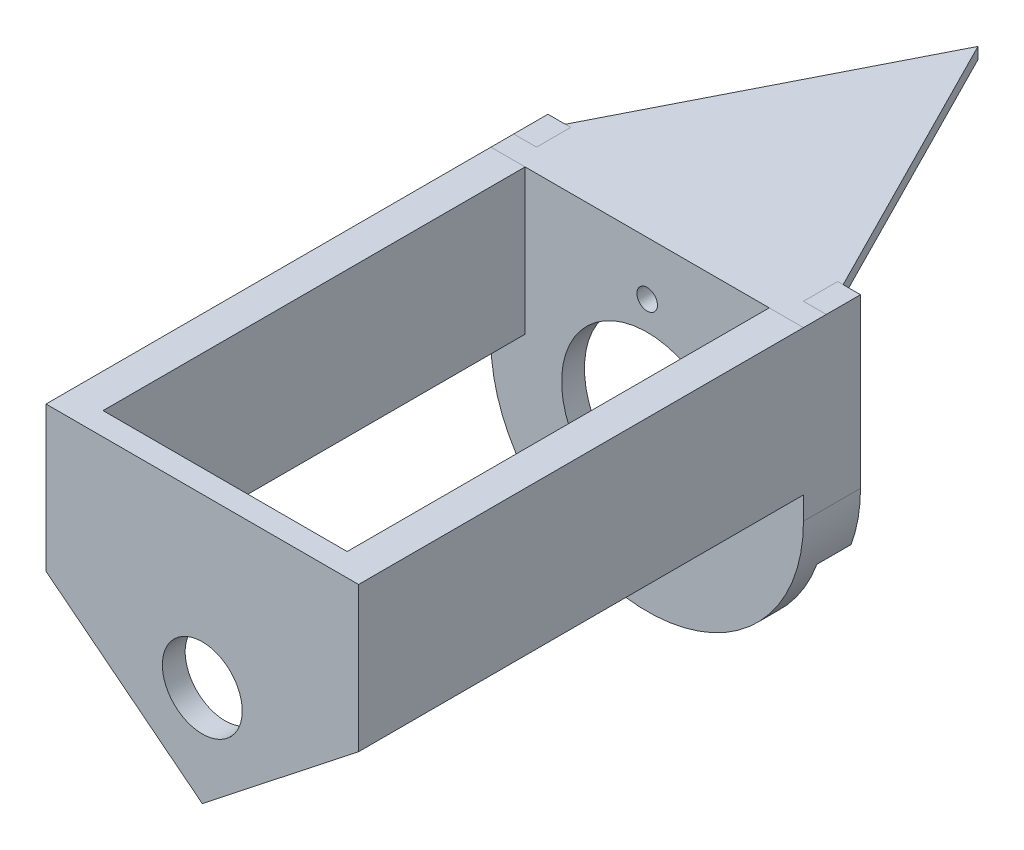
from build123d import *
from build123d.topology import SkipClean

# Parameters (mm, degrees)
BOSS_EXTRUDE1_DEPTH = 2
BOSS_EXTRUDE2_START = 3
BOSS_EXTRUDE2_DEPTH = 3
CUT_EXTRUDE1_REACH  = 22.009
SKETCH5_R           = 7.5
BOSS_EXTRUDE3_DEPTH = 1
SKETCH8_W           = 3
SKETCH8_H           = 5
BOSS_EXTRUDE4_DEPTH = 39
BOSS_EXTRUDE5_DEPTH = 2
CUT_EXTRUDE2_REACH  = 72.907
SKETCH10_R          = 3.5
CUT_EXTRUDE4_REACH  = 45.872
SKETCH11_R          = 0.9
BOSS_EXTRUDE6_DEPTH = 7.7
SKETCH16_W          = 2
SKETCH16_H          = 3
BOSS_EXTRUDE7_DEPTH = 14.7


with BuildPart() as part:
    # Sketch2 → Boss-Extrude1 (new body)
    with BuildSketch(Plane.XY):
        with BuildLine():
            ThreePointArc((13.7, 0), (9.687362902, 9.687362902), (0, 13.7))
            ThreePointArc((0, 13.7), (-9.687362902, 9.687362902), (-13.7, 0))
            Line((-13.7, 0), (13.7, 0))
        make_face()
        with BuildLine():
            Line((13.7, 0), (-13.7, 0))
            ThreePointArc((-13.7, 0), (0, -13.7), (13.7, 0))
        make_face()
        with BuildLine():
            Line((13.7, 13.7), (0, 13.7))
            ThreePointArc((0, 13.7), (9.687362902, 9.687362902), (13.7, 0))
            Line((13.7, 0), (13.7, 13.7))
        make_face()
        with BuildLine():
            Line((0, 13.7), (-13.7, 13.7))
            Line((-13.7, 13.7), (-13.7, 0))
            ThreePointArc((-13.7, 0), (-9.687362902, 9.687362902), (0, 13.7))
        make_face()
        with BuildLine():
            ThreePointArc((13.7, 0), (9.687362902, 9.687362902), (0, 13.7))
            ThreePointArc((0, 13.7), (-9.687362902, 9.687362902), (-13.7, 0))
            Line((-13.7, 0), (13.7, 0))
        make_face()
        with BuildLine():
            Line((13.7, 0), (-13.7, 0))
            ThreePointArc((-13.7, 0), (0, -13.7), (13.7, 0))
        make_face()
    extrude(amount=BOSS_EXTRUDE1_DEPTH)

    # Sketch3 → Boss-Extrude2 (add)
    with SkipClean():  # the faces are left unmerged after this step: merging them gives an invalid solid
        with BuildSketch(Plane(origin=(0, 0, 0), x_dir=(-1, 0, 0), z_dir=(0, 0, -1)).offset(BOSS_EXTRUDE2_START)):
            with BuildLine():
                Line((-11.7, 0), (-13.7, 0))
                ThreePointArc((-13.7, 0), (-13.491866216, -2.378980034), (-12.873788905, -4.685675964))
                Line((-12.873788905, -4.685675964), (-10.994403663, -4.001635677))
                ThreePointArc((-10.994403663, -4.001635677), (-11.52225071, -2.031683679), (-11.7, 0))
            make_face()
            with BuildLine():
                ThreePointArc((11.7, 0), (11.52225071, -2.031683679), (10.994403663, -4.001635677))
                Line((10.994403663, -4.001635677), (12.873788905, -4.685675964))
                ThreePointArc((12.873788905, -4.685675964), (13.491866216, -2.378980034), (13.7, 0))
                Line((13.7, 0), (11.7, 0))
            make_face()
        extrude(amount=-BOSS_EXTRUDE2_DEPTH)

    # Sketch5 → Cut-Extrude1 (cut, up to next)
    with BuildSketch(Plane.XY.offset(2), mode=Mode.PRIVATE) as cut_extrude1_sk1:
        Circle(SKETCH5_R)
    cut_extrude1_tool1 = extrude(cut_extrude1_sk1.sketch, amount=-CUT_EXTRUDE1_REACH, mode=Mode.PRIVATE) & part.part
    add(cut_extrude1_tool1.solids().sort_by_distance((0, 0, 2))[0], mode=Mode.SUBTRACT)

    # Sketch7 → Boss-Extrude3 (add)
    with SkipClean():  # the faces are left unmerged after this step: merging them gives an invalid solid
        with BuildSketch(Plane(origin=(0, 13.7, 0), x_dir=(1, 0, 0), z_dir=(0, 1, 0))):
            Polygon((0, 0), (13.7, 0), (0, 27), (-13.7, 0), align=None)
            Polygon((13.7, -2), (13.7, 0), (0, 0), (-13.7, 0), (-13.7, -2), align=None)
        extrude(amount=BOSS_EXTRUDE3_DEPTH)

    # Sketch8 → Boss-Extrude4 (add)
    with SkipClean():  # the faces are left unmerged after this step: merging them gives an invalid solid
        with BuildSketch(Plane.XY.offset(2)):
            with Locations((-12.2, 4.5)):
                Rectangle(SKETCH8_W, SKETCH8_H)
            with Locations((12.2, 4.5)):
                Rectangle(SKETCH8_W, SKETCH8_H)
        extrude(amount=BOSS_EXTRUDE4_DEPTH)

    # Sketch9 → Boss-Extrude5 (add)
    with SkipClean():  # the faces are left unmerged after this step: merging them gives an invalid solid
        with BuildSketch(Plane.XY.offset(41)):
            Polygon((-10.7, 2), (-13.7, 2), (0, -8.786353055), (13.7, 2), (10.7, 2), (10.7, 7), (-10.7, 7), align=None)
        extrude(amount=-BOSS_EXTRUDE5_DEPTH)

    # Sketch10 → Cut-Extrude2 (cut, up to next)
    with BuildSketch(Plane.XY.offset(41), mode=Mode.PRIVATE) as cut_extrude2_sk1:
        Circle(SKETCH10_R)
    cut_extrude2_tool1 = extrude(cut_extrude2_sk1.sketch, amount=-CUT_EXTRUDE2_REACH, mode=Mode.PRIVATE) & part.part
    add(cut_extrude2_tool1.solids().sort_by_distance((0, 0, 41))[0], mode=Mode.SUBTRACT)

    # Sketch11 → Cut-Extrude4 (cut, up to next)
    with BuildSketch(Plane.XY.offset(2), mode=Mode.PRIVATE) as cut_extrude4_sk1:
        with Locations((0, 10)):
            Circle(SKETCH11_R)
    cut_extrude4_tool1 = extrude(cut_extrude4_sk1.sketch, amount=-CUT_EXTRUDE4_REACH, mode=Mode.PRIVATE) & part.part
    # Sketch11 → Cut-Extrude4 (cut, up to next)
    with BuildSketch(Plane.XY.offset(2), mode=Mode.PRIVATE) as cut_extrude4_sk2:
        with Locations((0, -10)):
            Circle(SKETCH11_R)
    cut_extrude4_tool2 = extrude(cut_extrude4_sk2.sketch, amount=-CUT_EXTRUDE4_REACH, mode=Mode.PRIVATE) & part.part
    add(cut_extrude4_tool1.solids().sort_by_distance((0, 10, 2))[0], mode=Mode.SUBTRACT)
    add(cut_extrude4_tool2.solids().sort_by_distance((0, -10, 2))[0], mode=Mode.SUBTRACT)

    # Sketch15 → Boss-Extrude6 (add, through all)
    with SkipClean():  # the faces are left unmerged after this step: merging them gives an invalid solid
        with BuildSketch(Plane(origin=(0, 7, 0), x_dir=(1, 0, 0), z_dir=(0, 1, 0))):
            Polygon((-10.7, -2), (-13.7, -2), (-13.7, -41), (13.7, -41), (13.7, -2), (10.7, -2), (10.7, -39), (-10.7, -39), align=None)
        extrude(amount=BOSS_EXTRUDE6_DEPTH)

    # Sketch16 → Boss-Extrude7 (add, through all)
    with SkipClean():  # the faces are left unmerged after this step: merging them gives an invalid solid
        with BuildSketch(Plane(origin=(0, 0, 0), x_dir=(1, 0, 0), z_dir=(0, 1, 0))):
            with Locations((12.7, 1.5)):
                Rectangle(SKETCH16_W, SKETCH16_H)
            with Locations((-12.7, 1.5)):
                Rectangle(SKETCH16_W, SKETCH16_H)
        extrude(amount=BOSS_EXTRUDE7_DEPTH)


solid = part.part
